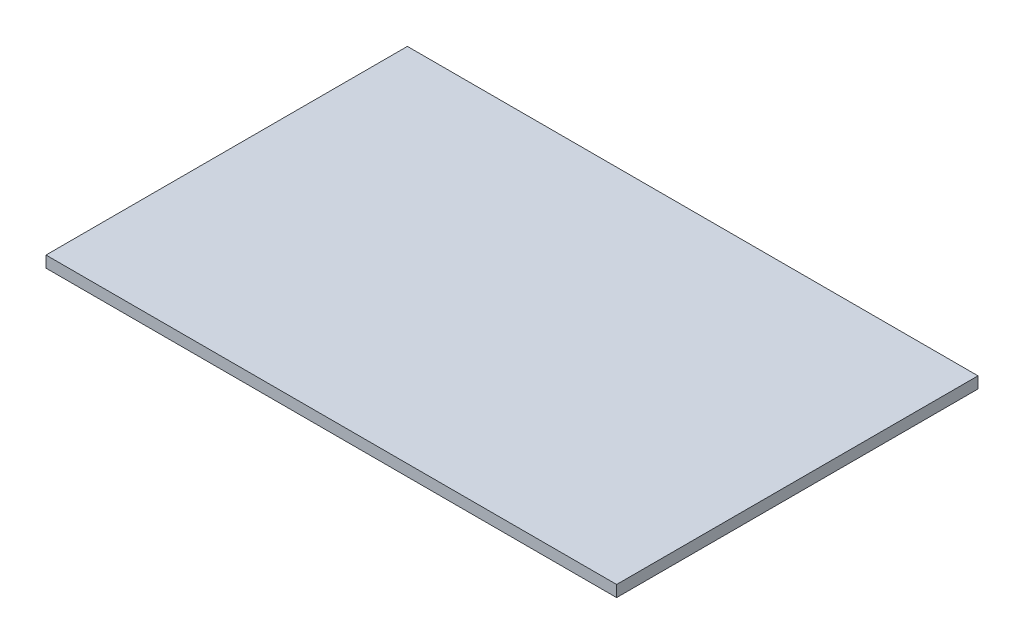
from build123d import *

# Parameters (mm, degrees)
SKETCH1_W           = 952.5
SKETCH1_H           = 603.25
BOSS_EXTRUDE1_DEPTH = 19.05


with BuildPart() as part:
    # Sketch1 → Boss-Extrude1 (new body)
    with BuildSketch(Plane(origin=(0, 0, 0), x_dir=(1, 0, 0), z_dir=(0, 1, 0))):
        with Locations((0, -3.175)):
            Rectangle(SKETCH1_W, SKETCH1_H)
    extrude(amount=-BOSS_EXTRUDE1_DEPTH)


solid = part.part
